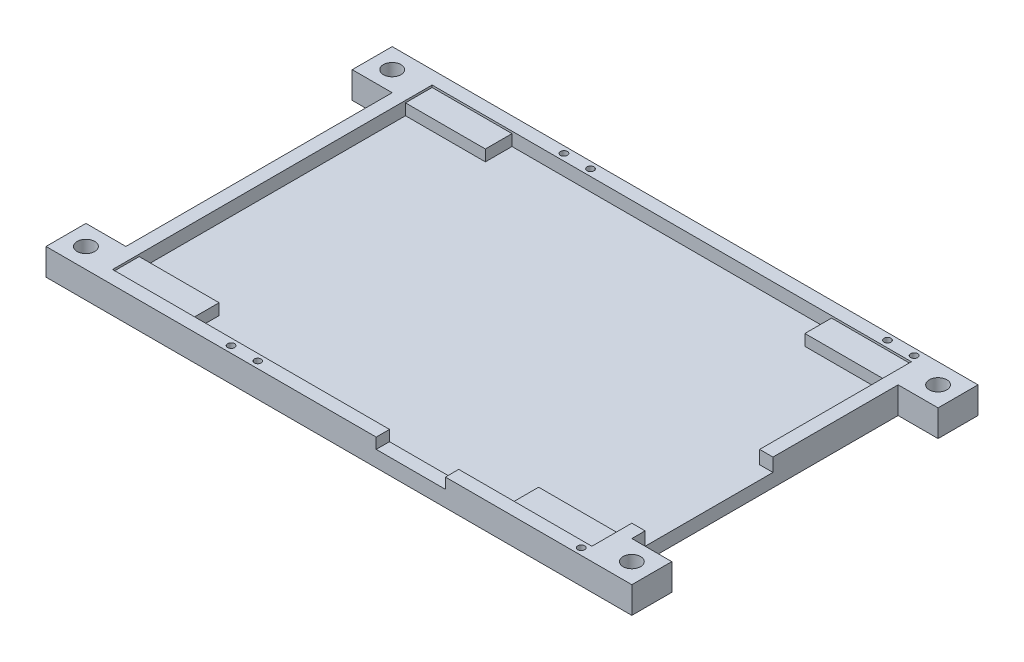
from build123d import *

# Parameters (mm, degrees)
SKETCH1_W           = 95
SKETCH1_H           = 65
BOSS_EXTRUDE1_DEPTH = 5
SKETCH3_W           = 90
SKETCH3_H           = 60
CUT_EXTRUDE1_DEPTH  = 2.5
SKETCH5_W           = 15
SKETCH5_H           = 5
BOSS_EXTRUDE2_DEPTH = 2.1
SKETCH14_W          = 13
SKETCH14_H          = 2
CUT_EXTRUDE3_DEPTH  = 2.5
CUT_EXTRUDE5_REACH  = 117.217
SKETCH17_W          = 24
SKETCH17_H          = 2.5
SKETCH18_R          = 0.65
CUT_EXTRUDE6_DEPTH  = 2.5
SKETCH19_W          = 7.5
SKETCH19_H          = 5
BOSS_EXTRUDE3_DEPTH = 7.5
SKETCH20_W          = 7.5
SKETCH20_H          = 5
BOSS_EXTRUDE4_DEPTH = 7.5
SKETCH21_R          = 1.65
CUT_EXTRUDE7_DEPTH  = 122.475306133


with BuildPart() as part:
    # Sketch1 → Boss-Extrude1 (new body)
    with BuildSketch(Plane(origin=(0, 0, 0), x_dir=(1, 0, 0), z_dir=(0, 1, 0))):
        with Locations((47.5, 32.5)):
            Rectangle(SKETCH1_W, SKETCH1_H)
    extrude(amount=-BOSS_EXTRUDE1_DEPTH)

    # Sketch3 → Cut-Extrude1 (cut)
    with BuildSketch(Plane(origin=(0, 0, 0), x_dir=(1, 0, 0), z_dir=(0, 1, 0))):
        with Locations((47.5, 32.5)):
            Rectangle(SKETCH3_W, SKETCH3_H)
    extrude(amount=-CUT_EXTRUDE1_DEPTH, mode=Mode.SUBTRACT)

    # Sketch5 → Boss-Extrude2 (add)
    with BuildSketch(Plane(origin=(0, -2.5, 0), x_dir=(1, 0, 0), z_dir=(0, 1, 0))):
        with Locations((10, 60)):
            Rectangle(SKETCH5_W, SKETCH5_H)
        with Locations((10, 5)):
            Rectangle(SKETCH5_W, SKETCH5_H)
        with Locations((85, 60)):
            Rectangle(SKETCH5_W, SKETCH5_H)
        with Locations((85, 5)):
            Rectangle(SKETCH5_W, SKETCH5_H)
    extrude(amount=BOSS_EXTRUDE2_DEPTH)

    # Sketch14 → Cut-Extrude3 (cut)
    with BuildSketch(Plane.XY):
        with Locations((61, -1)):
            Rectangle(SKETCH14_W, SKETCH14_H)
    extrude(amount=-CUT_EXTRUDE3_DEPTH, mode=Mode.SUBTRACT)

    # Sketch17 → Cut-Extrude5 (cut, up to next)
    with BuildSketch(Plane(origin=(95, 0, 0), x_dir=(0, 0, -1), z_dir=(1, 0, 0)), mode=Mode.PRIVATE) as cut_extrude5_sk1:
        with Locations((22, -1.25)):
            Rectangle(SKETCH17_W, SKETCH17_H)
    cut_extrude5_tool1 = extrude(cut_extrude5_sk1.sketch, amount=-CUT_EXTRUDE5_REACH, mode=Mode.PRIVATE) & part.part
    add(cut_extrude5_tool1.solids().sort_by_distance((95, -1.25, -22))[0], mode=Mode.SUBTRACT)

    # Sketch18 → Cut-Extrude6 (cut)
    with BuildSketch(Plane(origin=(0, 0, 0), x_dir=(1, 0, 0), z_dir=(0, 1, 0))):
        with Locations(Location((91.75, 63.75, 0), (0, 0, 270))):
            Circle(SKETCH18_R)
        with Locations(Location((86.75, 63.75, 0), (0, 0, 270))):
            Circle(SKETCH18_R)
        with Locations(Location((91.75, 1.25, 0), (0, 0, 90))):
            Circle(SKETCH18_R)
        with Locations(Location((26, 63.75, 0), (0, 0, 90))):
            Circle(SKETCH18_R)
        with Locations(Location((31, 63.75, 0), (0, 0, 90))):
            Circle(SKETCH18_R)
        with Locations(Location((26, 1.25, 0), (0, 0, 270))):
            Circle(SKETCH18_R)
        with Locations(Location((31, 1.25, 0), (0, 0, 270))):
            Circle(SKETCH18_R)
    extrude(amount=-CUT_EXTRUDE6_DEPTH, mode=Mode.SUBTRACT)

    # Sketch19 → Boss-Extrude3 (add)
    with BuildSketch(Plane.ZY):
        with Locations((-61.25, -2.5)):
            Rectangle(SKETCH19_W, SKETCH19_H)
        with Locations((-3.75, -2.5)):
            Rectangle(SKETCH19_W, SKETCH19_H)
    extrude(amount=BOSS_EXTRUDE3_DEPTH)

    # Sketch20 → Boss-Extrude4 (add)
    with BuildSketch(Plane(origin=(95, 0, 0), x_dir=(0, 0, -1), z_dir=(1, 0, 0))):
        with Locations((3.75, -2.5)):
            Rectangle(SKETCH20_W, SKETCH20_H)
        with Locations((61.25, -2.5)):
            Rectangle(SKETCH20_W, SKETCH20_H)
    extrude(amount=BOSS_EXTRUDE4_DEPTH)

    # Sketch21 → Cut-Extrude7 (cut, through all)
    with BuildSketch(Plane(origin=(0, 0, 0), x_dir=(1, 0, 0), z_dir=(0, 1, 0))):
        with Locations(Location((-3.75, 61.25, 0), (0, 0, 270))):
            Circle(SKETCH21_R)
        with Locations(Location((98.75, 61.25, 0), (0, 0, 90))):
            Circle(SKETCH21_R)
        with Locations(Location((98.75, 3.75, 0), (0, 0, 270))):
            Circle(SKETCH21_R)
        with Locations(Location((-3.75, 3.75, 0), (0, 0, 90))):
            Circle(SKETCH21_R)
    extrude(amount=-CUT_EXTRUDE7_DEPTH, mode=Mode.SUBTRACT)


solid = part.part
